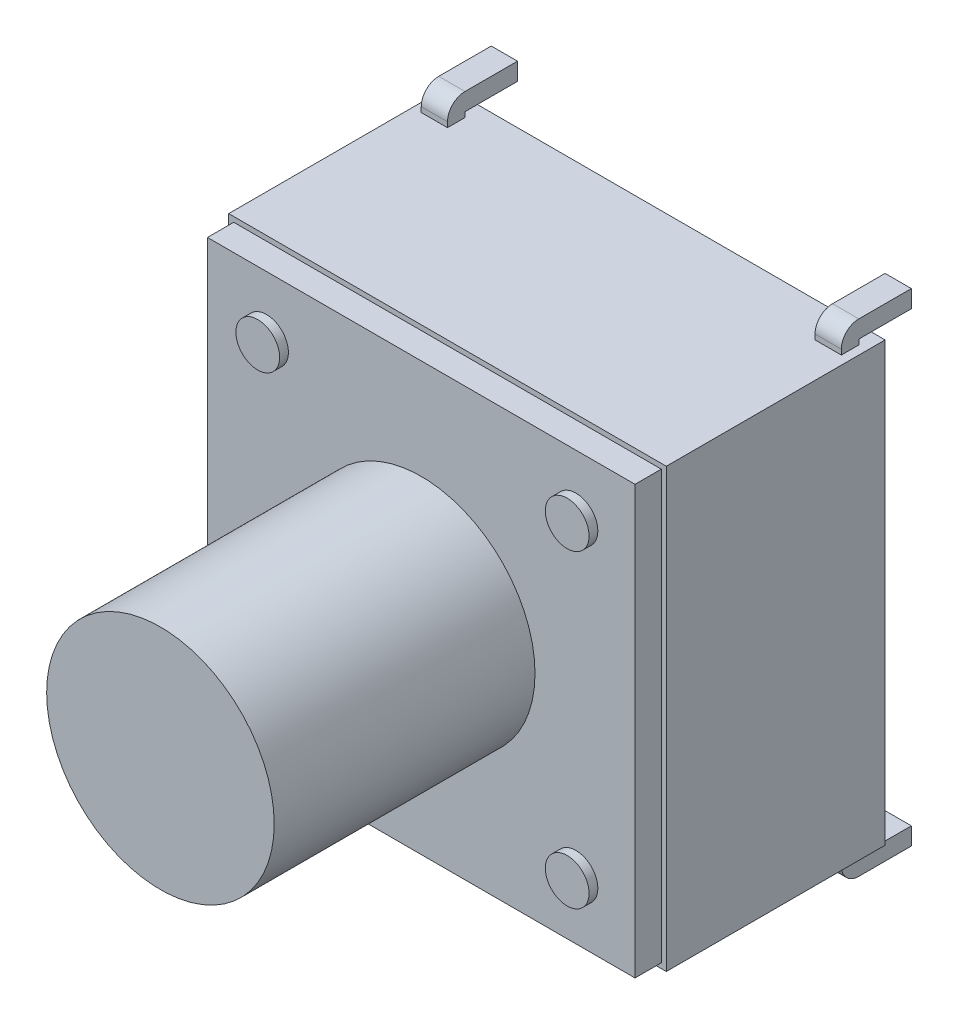
from build123d import *

# Parameters (mm, degrees)
SKETCH1_W           = 6.35
SKETCH1_H           = 6.35
BOSS_EXTRUDE1_DEPTH = 3.175
SKETCH2_W           = 6.204293306
SKETCH2_H           = 6.204293306
BOSS_EXTRUDE2_DEPTH = 0.381
BOSS_EXTRUDE3_DEPTH = 0.381
BOSS_EXTRUDE4_START = -0.381
BOSS_EXTRUDE4_DEPTH = 0.381
BOSS_EXTRUDE5_REACH = 8.318
SKETCH5_R           = 0.3175
SKETCH6_R           = 1.651
BOSS_EXTRUDE6_DEPTH = 3.7846


with BuildPart() as part:
    # Sketch1 → Boss-Extrude1 (new body)
    with BuildSketch(Plane.XY.offset(3.175)):
        Rectangle(SKETCH1_W, SKETCH1_H)
    extrude(amount=-BOSS_EXTRUDE1_DEPTH)

    # Sketch2 → Boss-Extrude2 (add)
    with BuildSketch(Plane.XY.offset(3.556)):
        Rectangle(SKETCH2_W, SKETCH2_H)
    extrude(amount=-BOSS_EXTRUDE2_DEPTH)

    # Sketch3 → Boss-Extrude3 (add)
    with BuildSketch(Plane(origin=(2.667, 0, 0), x_dir=(0, -1, 0), z_dir=(-1, 0, 0))):
        with BuildLine():
            Line((3.24894616, 0.254), (3.24894616, -0.508))
            Line((3.24894616, -0.508), (3.50294616, -0.508))
            Line((3.50294616, -0.508), (3.50294616, 0.254))
            ThreePointArc((3.50294616, 0.254), (3.428551282, 0.433605122), (3.24894616, 0.508))
            Line((3.24894616, 0.508), (3.175, 0.508))
            Line((3.175, 0.508), (3.175, 0.254))
            Line((3.175, 0.254), (3.24894616, 0.254))
        make_face()
        with BuildLine():
            Line((-3.50294616, 0.254), (-3.50294616, -0.508))
            Line((-3.50294616, -0.508), (-3.24894616, -0.508))
            Line((-3.24894616, -0.508), (-3.24894616, 0.254))
            Line((-3.24894616, 0.254), (-3.175, 0.254))
            Line((-3.175, 0.254), (-3.175, 0.508))
            Line((-3.175, 0.508), (-3.24894616, 0.508))
            ThreePointArc((-3.24894616, 0.508), (-3.428551282, 0.433605122), (-3.50294616, 0.254))
        make_face()
    extrude(amount=-BOSS_EXTRUDE3_DEPTH)

    # Sketch4 → Boss-Extrude4 (add)
    with BuildSketch(Plane(origin=(-2.667, 0, 0), x_dir=(0, 0, -1), z_dir=(1, 0, 0)).offset(BOSS_EXTRUDE4_START)):
        with BuildLine():
            Line((-0.254, -3.50294616), (0.508, -3.50294616))
            Line((0.508, -3.50294616), (0.508, -3.24894616))
            Line((0.508, -3.24894616), (-0.254, -3.24894616))
            Line((-0.254, -3.24894616), (-0.254, -3.175))
            Line((-0.254, -3.175), (-0.508, -3.175))
            Line((-0.508, -3.175), (-0.508, -3.24894616))
            ThreePointArc((-0.508, -3.24894616), (-0.433605122, -3.428551282), (-0.254, -3.50294616))
        make_face()
        with BuildLine():
            Line((-0.508, 3.24894616), (-0.508, 3.175))
            Line((-0.508, 3.175), (-0.254, 3.175))
            Line((-0.254, 3.175), (-0.254, 3.24894616))
            Line((-0.254, 3.24894616), (0.508, 3.24894616))
            Line((0.508, 3.24894616), (0.508, 3.50294616))
            Line((0.508, 3.50294616), (-0.254, 3.50294616))
            ThreePointArc((-0.254, 3.50294616), (-0.433605122, 3.428551282), (-0.508, 3.24894616))
        make_face()
    extrude(amount=BOSS_EXTRUDE4_DEPTH)

    # Sketch5 → Boss-Extrude5 (add, up to next)
    with BuildSketch(Plane.XY.offset(3.683), mode=Mode.PRIVATE) as boss_extrude5_sk1:
        with Locations((2.24506403, -2.24506403)):
            Circle(SKETCH5_R)
    boss_extrude5_tool1 = extrude(boss_extrude5_sk1.sketch, amount=-BOSS_EXTRUDE5_REACH, mode=Mode.PRIVATE) - part.part
    # Sketch5 → Boss-Extrude5 (add, up to next)
    with BuildSketch(Plane.XY.offset(3.683), mode=Mode.PRIVATE) as boss_extrude5_sk2:
        with Locations((-2.24506403, -2.24506403)):
            Circle(SKETCH5_R)
    boss_extrude5_tool2 = extrude(boss_extrude5_sk2.sketch, amount=-BOSS_EXTRUDE5_REACH, mode=Mode.PRIVATE) - part.part
    # Sketch5 → Boss-Extrude5 (add, up to next)
    with BuildSketch(Plane.XY.offset(3.683), mode=Mode.PRIVATE) as boss_extrude5_sk3:
        with Locations((-2.24506403, 2.24506403)):
            Circle(SKETCH5_R)
    boss_extrude5_tool3 = extrude(boss_extrude5_sk3.sketch, amount=-BOSS_EXTRUDE5_REACH, mode=Mode.PRIVATE) - part.part
    # Sketch5 → Boss-Extrude5 (add, up to next)
    with BuildSketch(Plane.XY.offset(3.683), mode=Mode.PRIVATE) as boss_extrude5_sk4:
        with Locations((2.24506403, 2.24506403)):
            Circle(SKETCH5_R)
    boss_extrude5_tool4 = extrude(boss_extrude5_sk4.sketch, amount=-BOSS_EXTRUDE5_REACH, mode=Mode.PRIVATE) - part.part
    add(boss_extrude5_tool1.solids().sort_by_distance((2.245064, -2.245064, 3.683))[0])
    add(boss_extrude5_tool2.solids().sort_by_distance((-2.245064, -2.245064, 3.683))[0])
    add(boss_extrude5_tool3.solids().sort_by_distance((-2.245064, 2.245064, 3.683))[0])
    add(boss_extrude5_tool4.solids().sort_by_distance((2.245064, 2.245064, 3.683))[0])

    # Sketch6 → Boss-Extrude6 (add)
    with BuildSketch(Plane.XY.offset(7.3406)):
        Circle(SKETCH6_R)
    extrude(amount=-BOSS_EXTRUDE6_DEPTH)


solid = part.part
